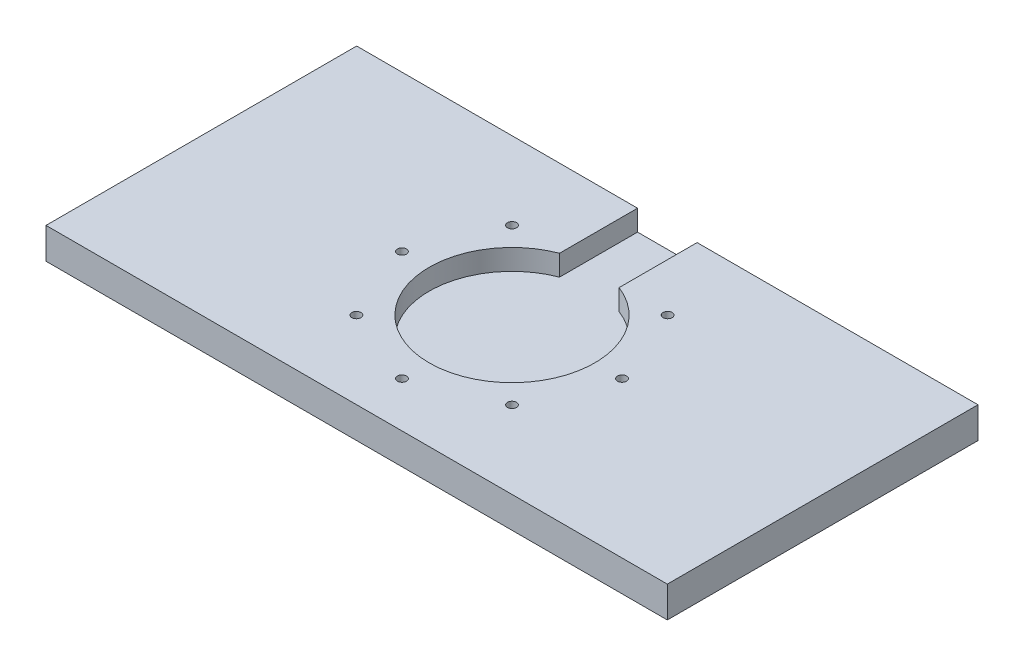
from build123d import *

# Parameters (mm, degrees)
SKETCH1_W           = 240
SKETCH1_H           = 120
BOSS_EXTRUDE1_DEPTH = 12
SKETCH2_R           = 32
CUT_EXTRUDE1_DEPTH  = 8
SKETCH3_W           = 23
SKETCH3_H           = 30.466372505
CUT_EXTRUDE2_DEPTH  = 8
SKETCH4_R           = 1.75
CUT_EXTRUDE4_DEPTH  = 20
SKETCH5_R           = 3
CUT_EXTRUDE7_DEPTH  = 5


with BuildPart() as part:
    # Sketch1 → Boss-Extrude1 (new body)
    with BuildSketch(Plane(origin=(0, 0, 0), x_dir=(1, 0, 0), z_dir=(0, 1, 0))):
        Rectangle(SKETCH1_W, SKETCH1_H)
    extrude(amount=-BOSS_EXTRUDE1_DEPTH)

    # Sketch2 → Cut-Extrude1 (cut)
    with BuildSketch(Plane(origin=(0, 0, 0), x_dir=(1, 0, 0), z_dir=(0, 1, 0))):
        with Locations(Location((0, 0, 0), (0, 0, 270))):
            Circle(SKETCH2_R)
    extrude(amount=-CUT_EXTRUDE1_DEPTH, mode=Mode.SUBTRACT)

    # Sketch3 → Cut-Extrude2 (cut)
    with BuildSketch(Plane(origin=(0, 0, 0), x_dir=(1, 0, 0), z_dir=(0, 1, 0))):
        with Locations((0, 44.766813748)):
            Rectangle(SKETCH3_W, SKETCH3_H)
    extrude(amount=-CUT_EXTRUDE2_DEPTH, mode=Mode.SUBTRACT)

    # Sketch4 → Cut-Extrude4 (cut)
    with BuildSketch(Plane(origin=(0, 0, 0), x_dir=(1, 0, 0), z_dir=(0, 1, 0))):
        with Locations(Location((-42.5, 0, 0), (0, 0, 270))):
            Circle(SKETCH4_R)
        with Locations(Location((-30.0520382, 30.0520382, 0), (0, 0, 270))):
            Circle(SKETCH4_R)
        with Locations(Location((30.0520382, 30.0520382, 0), (0, 0, 270))):
            Circle(SKETCH4_R)
        with Locations(Location((42.5, 0, 0), (0, 0, 270))):
            Circle(SKETCH4_R)
        with Locations(Location((30.0520382, -30.0520382, 0), (0, 0, 270))):
            Circle(SKETCH4_R)
        with Locations(Location((0, -42.5, 0), (0, 0, 270))):
            Circle(SKETCH4_R)
        with Locations(Location((-30.0520382, -30.0520382, 0), (0, 0, 270))):
            Circle(SKETCH4_R)
    extrude(amount=-CUT_EXTRUDE4_DEPTH, mode=Mode.SUBTRACT)

    # Sketch5 → Cut-Extrude7 (cut)
    with BuildSketch(Plane(origin=(0, -12, 0), x_dir=(1, 0, 0), z_dir=(0, 1, 0))):
        with Locations(Location((-42.5, 0, 0), (0, 0, 270))):
            Circle(SKETCH5_R)
        with Locations(Location((-30.0520382, 30.0520382, 0), (0, 0, 270))):
            Circle(SKETCH5_R)
        with Locations(Location((30.0520382, 30.0520382, 0), (0, 0, 270))):
            Circle(SKETCH5_R)
        with Locations(Location((42.5, 0, 0), (0, 0, 270))):
            Circle(SKETCH5_R)
        with Locations(Location((30.0520382, -30.0520382, 0), (0, 0, 270))):
            Circle(SKETCH5_R)
        with Locations(Location((0, -42.5, 0), (0, 0, 270))):
            Circle(SKETCH5_R)
        with Locations(Location((-30.0520382, -30.0520382, 0), (0, 0, 270))):
            Circle(SKETCH5_R)
    extrude(amount=CUT_EXTRUDE7_DEPTH, mode=Mode.SUBTRACT)


solid = part.part
